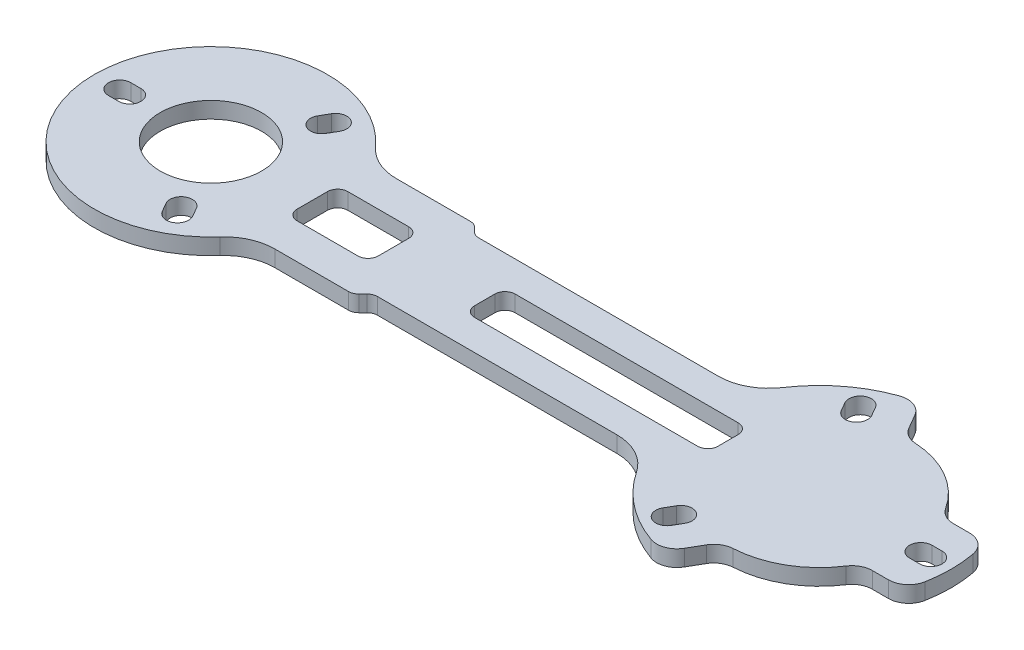
from build123d import *

# Parameters (mm, degrees)
BOSS_EXTRUDE1_DEPTH = 1.6
CUT_EXTRUDE1_DEPTH  = 45.950639595
CUT_EXTRUDE2_DEPTH  = 45.950639595
FILLET1_R           = 5
SKETCH4_W           = 8
SKETCH4_H           = 5
CUT_EXTRUDE3_DEPTH  = 45.950639595
FILLET2_R           = 1
FILLET3_R           = 1
SKETCH6_W           = 24
SKETCH6_H           = 4
CUT_EXTRUDE4_DEPTH  = 45.950639595
SKETCH7_R           = 5
CUT_EXTRUDE5_DEPTH  = 45.950639595
FILLET4_R           = 1
CUT_EXTRUDE6_DEPTH  = 45.950639595
CIRPATTERN1_COUNT   = 2
CIRPATTERN1_ANGLE   = 120
FILLET5_R           = 2


with BuildPart() as part:
    # Sketch1 → Boss-Extrude1 (new body)
    with BuildSketch(Plane(origin=(0, 0, 0), x_dir=(1, 0, 0), z_dir=(0, 1, 0))):
        with BuildLine():
            Line((-9, 5), (18, 5))
            ThreePointArc((18, 5), (43, 0), (18, -5))
            Line((18, -5), (-9, -5))
            Line((-9, -5), (-10, -6))
            Line((-10, -6), (-20.189291565, -6))
            ThreePointArc((-20.189291565, -6), (-41.5, 0), (-20.189291565, 6))
            Line((-20.189291565, 6), (-10, 6))
            Line((-10, 6), (-9, 5))
        make_face()
    extrude(amount=BOSS_EXTRUDE1_DEPTH)

    # Sketch2 → Cut-Extrude1 (cut, through all)
    with BuildSketch(Plane(origin=(0, 0, 0), x_dir=(1, 0, 0), z_dir=(0, 1, 0))):
        with BuildLine():
            Line((40, 1.1), (41, 1.1))
            ThreePointArc((41, 1.1), (42.1, 0), (41, -1.1))
            Line((41, -1.1), (40, -1.1))
            ThreePointArc((40, -1.1), (38.9, 0), (40, 1.1))
        make_face()
        with BuildLine():
            Line((25.952627944, -9.210254038), (25.452627944, -10.076279442))
            ThreePointArc((25.452627944, -10.076279442), (23.95, -10.478907386), (23.547372056, -8.976279442))
            Line((23.547372056, -8.976279442), (24.047372056, -8.110254038))
            ThreePointArc((24.047372056, -8.110254038), (25.55, -7.707626094), (25.952627944, -9.210254038))
        make_face()
        with BuildLine():
            Line((24.047372056, 8.110254038), (23.547372056, 8.976279442))
            ThreePointArc((23.547372056, 8.976279442), (23.95, 10.478907386), (25.452627944, 10.076279442))
            Line((25.452627944, 10.076279442), (25.952627944, 9.210254038))
            ThreePointArc((25.952627944, 9.210254038), (25.55, 7.707626094), (24.047372056, 8.110254038))
        make_face()
    extrude(amount=CUT_EXTRUDE1_DEPTH, mode=Mode.SUBTRACT)

    # Sketch3 → Cut-Extrude2 (cut, through all)
    with BuildSketch(Plane(origin=(0, 0, 0), x_dir=(1, 0, 0), z_dir=(0, 1, 0))):
        with BuildLine():
            Line((-25.047372056, -6.37820323), (-24.547372056, -7.244228634))
            ThreePointArc((-24.547372056, -7.244228634), (-24.95, -8.746856578), (-26.452627944, -8.344228634))
            Line((-26.452627944, -8.344228634), (-26.952627944, -7.47820323))
            ThreePointArc((-26.952627944, -7.47820323), (-26.55, -5.975575286), (-25.047372056, -6.37820323))
        make_face()
        with BuildLine():
            Line((-38, -1.1), (-39, -1.1))
            ThreePointArc((-39, -1.1), (-40.1, 0), (-39, 1.1))
            Line((-39, 1.1), (-38, 1.1))
            ThreePointArc((-38, 1.1), (-36.9, 0), (-38, -1.1))
        make_face()
        with BuildLine():
            Line((-26.952627944, 7.47820323), (-26.452627944, 8.344228634))
            ThreePointArc((-26.452627944, 8.344228634), (-24.95, 8.746856578), (-24.547372056, 7.244228634))
            Line((-24.547372056, 7.244228634), (-25.047372056, 6.37820323))
            ThreePointArc((-25.047372056, 6.37820323), (-26.55, 5.975575286), (-26.952627944, 7.47820323))
        make_face()
    extrude(amount=CUT_EXTRUDE2_DEPTH, mode=Mode.SUBTRACT)

    # Fillet1
    fillet1_edges = [part.edges().sort_by_distance(p)[0] for p in [
        (18, 0.8, -5),
        (-20.189291565, 0.8, -6),
        (-20.189291565, 0.8, 6),
        (18, 0.8, 5),
    ]]
    fillet(fillet1_edges, radius=FILLET1_R)

    # Sketch4 → Cut-Extrude3 (cut, through all)
    with BuildSketch(Plane(origin=(0, 0, 0), x_dir=(1, 0, 0), z_dir=(0, 1, 0))):
        with Locations((-16, 0)):
            Rectangle(SKETCH4_W, SKETCH4_H)
    extrude(amount=CUT_EXTRUDE3_DEPTH, mode=Mode.SUBTRACT)

    # Fillet2
    fillet2_edges = [part.edges().sort_by_distance(p)[0] for p in [
        (-12, 0.8, 2.5),
        (-12, 0.8, -2.5),
        (-20, 0.8, 2.5),
        (-20, 0.8, -2.5),
    ]]
    fillet(fillet2_edges, radius=FILLET2_R)

    # Fillet3
    fillet3_edges = [part.edges().sort_by_distance(p)[0] for p in [
        (-9, 0.8, -5),
        (-10, 0.8, -6),
        (-10, 0.8, 6),
        (-9, 0.8, 5),
    ]]
    fillet(fillet3_edges, radius=FILLET3_R)

    # Sketch6 → Cut-Extrude4 (cut, through all)
    with BuildSketch(Plane(origin=(0, 1.6, 0), x_dir=(1, 0, 0), z_dir=(0, 1, 0))):
        with Locations((9, 0)):
            Rectangle(SKETCH6_W, SKETCH6_H)
    extrude(amount=-CUT_EXTRUDE4_DEPTH, mode=Mode.SUBTRACT)

    # Sketch7 → Cut-Extrude5 (cut, through all)
    with BuildSketch(Plane(origin=(0, 1.6, 0), x_dir=(1, 0, 0), z_dir=(0, 1, 0))):
        with Locations((-30, 0)):
            Circle(SKETCH7_R)
    extrude(amount=-CUT_EXTRUDE5_DEPTH, mode=Mode.SUBTRACT)

    # Fillet4
    fillet4_edges = [part.edges().sort_by_distance(p)[0] for p in [
        (21, 0.8, -2),
        (21, 0.8, 2),
        (-3, 0.8, 2),
        (-3, 0.8, -2),
    ]]
    fillet(fillet4_edges, radius=FILLET4_R)

    # Sketch8 → Cut-Extrude6 (cut, through all)
    with BuildSketch(Plane(origin=(0, 1.6, 0), x_dir=(1, 0, 0), z_dir=(0, 1, 0))):
        with BuildLine():
            Line((27.279443177, 12.712142643), (29.432972741, 8.982120022))
            ThreePointArc((29.432972741, 8.982120022), (34.5, 7.794228634), (38.062257748, 4))
            Line((38.062257748, 4), (42.369316877, 4))
            ThreePointArc((42.369316877, 4), (36.5, 11.258330249), (27.279443177, 12.712142643))
        make_face()
    cut_extrude6 = extrude(amount=-CUT_EXTRUDE6_DEPTH, mode=Mode.SUBTRACT)

    # CirPattern1: Cut-Extrude6 ×2 about axis
    cirpattern1_axis = Axis((30, -4.392088632, 0), (0, -1, 0))
    for i in range(1, CIRPATTERN1_COUNT):
        add(cut_extrude6.rotate(cirpattern1_axis, i * CIRPATTERN1_ANGLE / (CIRPATTERN1_COUNT - 1)), mode=Mode.SUBTRACT)

    # Fillet5
    fillet5_edges = [part.edges().sort_by_distance(p)[0] for p in [
        (38.062257748, 0.8, 4),
        (42.369316877, 0.8, 4),
        (42.369316877, 0.8, -4),
        (38.062257748, 0.8, -4),
        (29.432972741, 0.8, -8.982120022),
        (27.279443177, 0.8, -12.712142643),
        (27.279443177, 0.8, 12.712142643),
        (29.432972741, 0.8, 8.982120022),
    ]]
    fillet(fillet5_edges, radius=FILLET5_R)


solid = part.part
